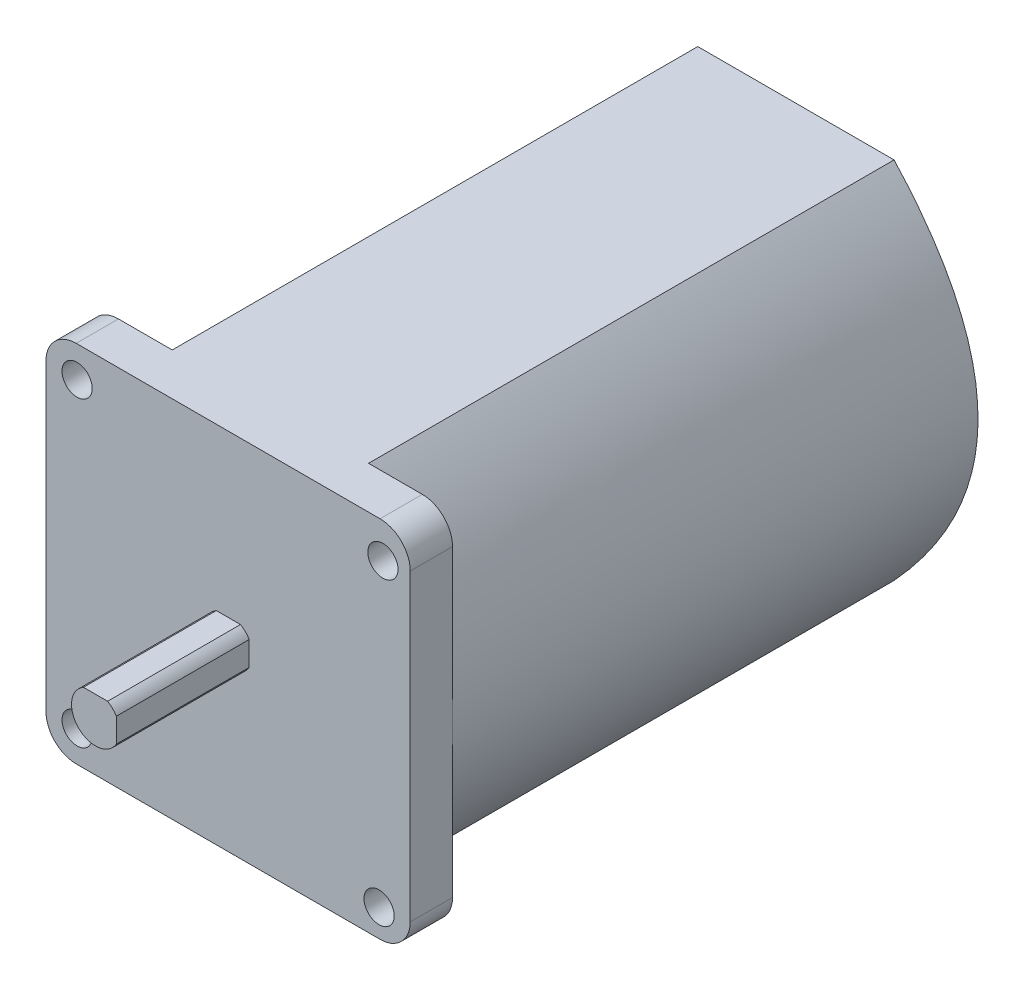
from build123d import *

# Parameters (mm, degrees)
BOSS_EXTRUDE1_DEPTH = 87
SKETCH2_R           = 2.5
BOSS_EXTRUDE2_DEPTH = 7
BOSS_EXTRUDE3_DEPTH = 22


with BuildPart() as part:
    # Sketch1 → Boss-Extrude1 (new body)
    with BuildSketch(Plane.XY):
        with BuildLine():
            Line((0, 0), (32.5, 0))
            add(Edge.make_bspline(
                [(32.5, 60.3), (60.3, 30.15), (32.5, 0)],
                knots=[0, 0, 0, 1, 1, 1], degree=2))
            Line((32.5, 60.3), (0, 60.3))
            add(Edge.make_bspline(
                [(0, 60.3), (-27.8, 30.15), (0, 0)],
                knots=[0, 0, 0, 1, 1, 1], degree=2))
        make_face()
    extrude(amount=BOSS_EXTRUDE1_DEPTH)

    # Sketch2 → Boss-Extrude2 (add)
    with BuildSketch(Plane.XY.offset(87)):
        with BuildLine():
            Line((-13.9, 55.3), (-13.9, 5))
            ThreePointArc((-13.9, 5), (-12.435533906, 1.464466094), (-8.9, 0))
            Line((-8.9, 0), (41.4, 0))
            ThreePointArc((41.4, 0), (44.935533906, 1.464466094), (46.4, 5))
            Line((46.4, 5), (46.4, 55.3))
            ThreePointArc((46.4, 55.3), (44.935533906, 58.835533906), (41.4, 60.3))
            Line((41.4, 60.3), (-8.9, 60.3))
            ThreePointArc((-8.9, 60.3), (-12.435533906, 58.835533906), (-13.9, 55.3))
        make_face()
        with Locations((-8.75, 55.15)):
            Circle(SKETCH2_R, mode=Mode.SUBTRACT)
        with Locations((-8.75, 5.15)):
            Circle(SKETCH2_R, mode=Mode.SUBTRACT)
        with Locations((41.246015607, 4.518792094)):
            Circle(SKETCH2_R, mode=Mode.SUBTRACT)
        with Locations((41.877223513, 54.514807701)):
            Circle(SKETCH2_R, mode=Mode.SUBTRACT)
    extrude(amount=BOSS_EXTRUDE2_DEPTH)

    # Sketch3 → Boss-Extrude3 (add)
    with BuildSketch(Plane.XY.offset(94)):
        with BuildLine():
            Line((18.300133509, 33.585203779), (14.300133509, 33.585203779))
            ThreePointArc((14.300133509, 33.585203779), (13.489384054, 27.339250545), (19.735337287, 28.15))
            Line((19.735337287, 28.15), (19.735337287, 32.15))
            ThreePointArc((19.735337287, 32.15), (19.110882964, 32.960749455), (18.300133509, 33.585203779))
        make_face()
    extrude(amount=BOSS_EXTRUDE3_DEPTH)


solid = part.part
